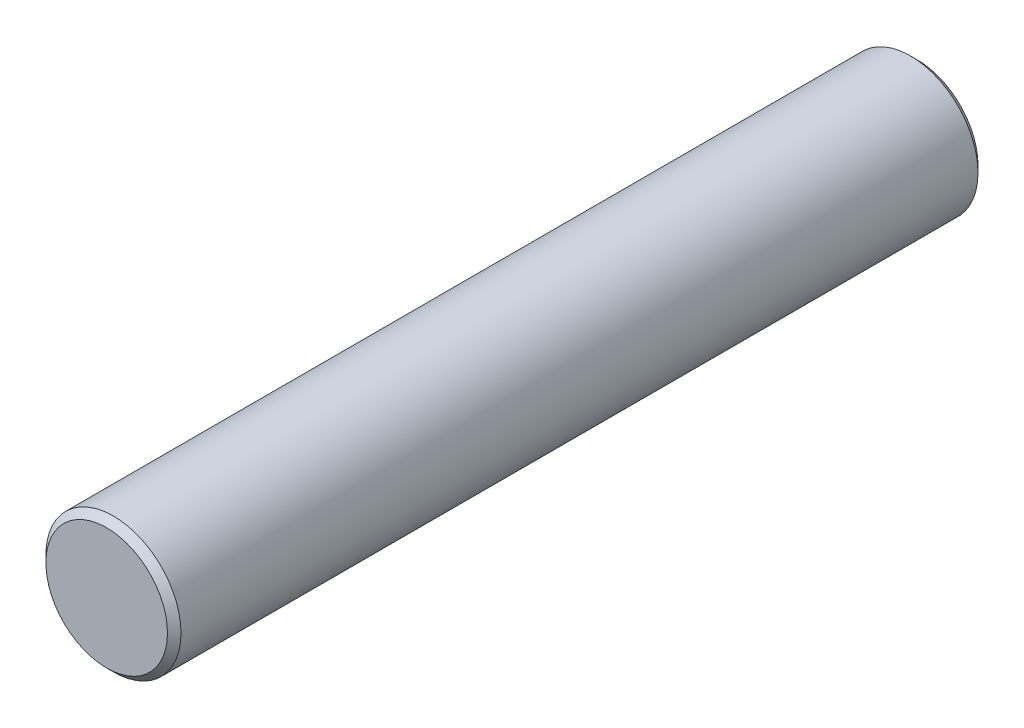
from build123d import *

# Parameters (mm, degrees)
ESQUISSE1_R        = 5
BOSS_EXTRU_1_DEPTH = 60
CHANFREIN1_SIZE    = 0.5


with BuildPart() as part:
    # Esquisse1 → Boss.-Extru.1 (new body)
    with BuildSketch(Plane.XY):
        Circle(ESQUISSE1_R)
    extrude(amount=BOSS_EXTRU_1_DEPTH)

    # Chanfrein1
    chanfrein1_edges = [part.edges().sort_by_distance(p)[0] for p in [
        (-5, 0, 0),
        (-5, 0, 60),
    ]]
    chamfer(chanfrein1_edges, length=CHANFREIN1_SIZE)


solid = part.part
